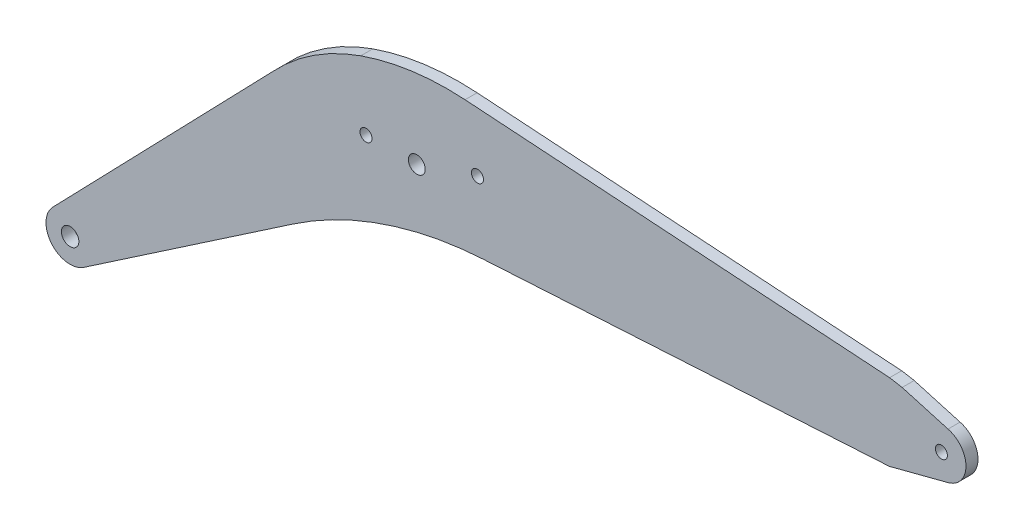
from build123d import *

# Parameters (mm, degrees)
SKETCH1_R           = 1.5
SKETCH1_R_2         = 2.1
SKETCH1_R_3         = 2.175
BOSS_EXTRUDE3_DEPTH = 3


with BuildPart() as part:
    # Sketch1 → Boss-Extrude3 (new body)
    with BuildSketch(Plane.XY):
        with BuildLine():
            Line((-128.173606683, 10.293399025), (-76.045238805, 45.70647235))
            ThreePointArc((-76.045238805, 45.70647235), (-53.507275984, 56.931628533), (-28.795238805, 61.75647235))
            Line((-28.795238805, 61.75647235), (72.257182683, 67.642360637))
            Line((72.257182683, 67.642360637), (86.853615252, 71.437479344))
            ThreePointArc((86.853615252, 71.437479344), (91.314459888, 77.20647235), (86.853615252, 82.975465356))
            Line((86.853615252, 82.975465356), (75.443530199, 86.236617693))
            Line((75.443530199, 86.236617693), (72.32406126, 86.780586344))
            Line((72.32406126, 86.780586344), (-33.295238805, 93.85647235))
            ThreePointArc((-33.295238805, 93.85647235), (-46.44497492, 93.411826928), (-59.240002329, 90.345796421))
            ThreePointArc((-59.240002329, 90.345796421), (-71.070665181, 84.517465038), (-81.145238805, 76.00647235))
            Line((-81.145238805, 76.00647235), (-135.858404881, 19.427395317))
            ThreePointArc((-135.858404881, 19.427395317), (-136.13643621, 11.393713442), (-128.173606683, 10.293399025))
        make_face()
        with Locations((85.204761195, 77.20647235)):
            Circle(SKETCH1_R, mode=Mode.SUBTRACT)
        with Locations((-45.295238805, 73.911181311)):
            Circle(SKETCH1_R_2, mode=Mode.SUBTRACT)
        with Locations((-131.545238805, 15.25647235)):
            Circle(SKETCH1_R_3, mode=Mode.SUBTRACT)
        with Locations((-57.927136979, 73.911181311)):
            Circle(SKETCH1_R, mode=Mode.SUBTRACT)
        with Locations((-30.210957337, 78.946585736)):
            Circle(SKETCH1_R, mode=Mode.SUBTRACT)
    extrude(amount=BOSS_EXTRUDE3_DEPTH)


solid = part.part
